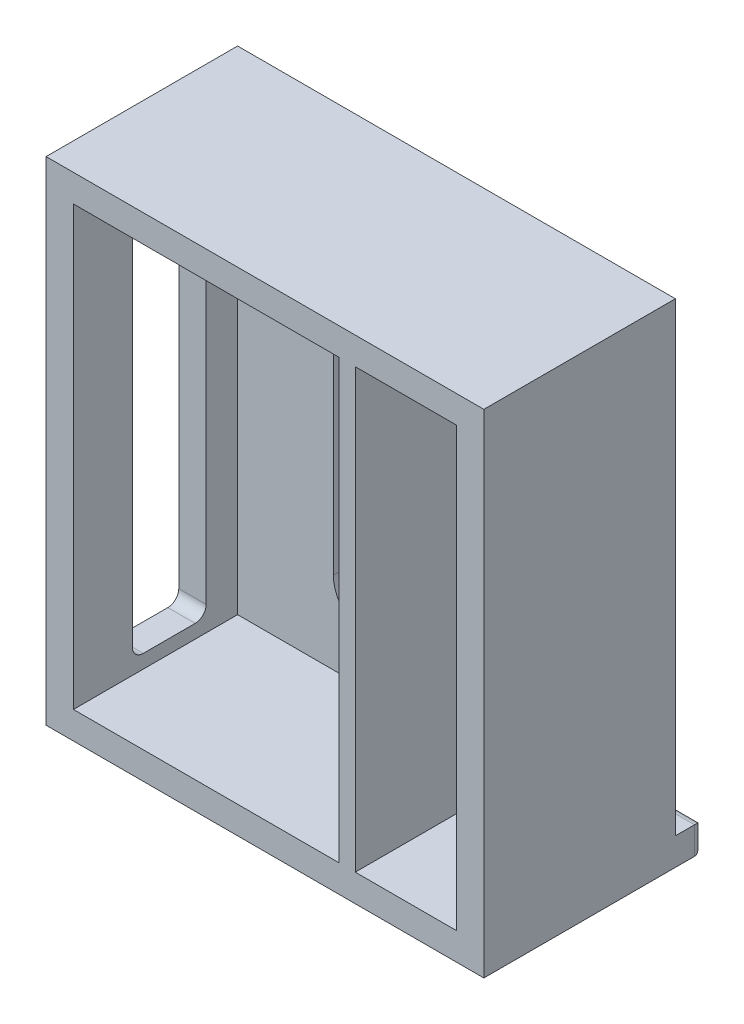
from build123d import *

# Parameters (mm, degrees)
SKETCH_1_W          = 160
SKETCH_1_H          = 70
EXTRUDE_1_DEPTH     = 180
SHELL_1_T           = -10
SKETCH_2_W          = 3
SKETCH_2_H          = 70
EXTRUDE_2_DEPTH     = 170
CUT_EXTRUDE_1_DEPTH = 170
CUT_EXTRUDE_2_DEPTH = 170
CUT_EXTRUDE_3_REACH = 245.362
SKETCH_6_W          = 160
SKETCH_6_H          = 10
EXTRUDE_3_DEPTH     = 10
FILLET_1_R          = 3


with BuildPart() as part:
    # 草图1 → 凸台-拉伸1 (new body)
    with BuildSketch(Plane(origin=(0, 0, 0), x_dir=(1, 0, 0), z_dir=(0, 1, 0))):
        Rectangle(SKETCH_1_W, SKETCH_1_H)
    extrude(amount=EXTRUDE_1_DEPTH)

    # 抽壳1
    shell_1_openings = [part.faces().sort_by_distance(p)[0] for p in [
        (0, 90, 35),
    ]]
    offset(amount=SHELL_1_T, openings=shell_1_openings, kind=Kind.INTERSECTION)

    # 草图2 → 凸台-拉伸2 (add)
    with BuildSketch(Plane.XZ):
        with Locations((31.5, 0)):
            Rectangle(SKETCH_2_W, SKETCH_2_H)
        with Locations((28.5, 0)):
            Rectangle(SKETCH_2_W, SKETCH_2_H)
    extrude(amount=-EXTRUDE_2_DEPTH)

    # 草图3 → 切除-拉伸1 (cut)
    with BuildSketch(Plane.XY.offset(-25)):
        with BuildLine():
            Line((-8, 140), (-8, 40))
            ThreePointArc((-8, 40), (-21.5, 26.5), (-35, 40))
            Line((-35, 40), (-35, 140))
            ThreePointArc((-35, 140), (-21.5, 153.5), (-8, 140))
        make_face()
    extrude(amount=-CUT_EXTRUDE_1_DEPTH, mode=Mode.SUBTRACT)

    # 草图4 → 切除-拉伸2 (cut)
    with BuildSketch(Plane.XY.offset(-25)):
        with BuildLine():
            Line((59, 137.5), (59, 42.5))
            ThreePointArc((59, 42.5), (51.5, 35), (44, 42.5))
            Line((44, 42.5), (44, 137.5))
            ThreePointArc((44, 137.5), (51.5, 145), (59, 137.5))
        make_face()
    extrude(amount=-CUT_EXTRUDE_2_DEPTH, mode=Mode.SUBTRACT)

    # 草图5 → 切除-拉伸3 (cut, up to next)
    with BuildSketch(Plane.ZY.offset(80), mode=Mode.PRIVATE) as cut_extrude_3_sk1:
        with BuildLine():
            Line((-9.5, 165), (9.5, 165))
            ThreePointArc((9.5, 165), (12.328427125, 163.828427125), (13.5, 161))
            Line((13.5, 161), (13.5, 19))
            ThreePointArc((13.5, 19), (12.328427125, 16.171572875), (9.5, 15))
            Line((9.5, 15), (-9.5, 15))
            ThreePointArc((-9.5, 15), (-12.328427125, 16.171572875), (-13.5, 19))
            Line((-13.5, 19), (-13.5, 161))
            ThreePointArc((-13.5, 161), (-12.328427125, 163.828427125), (-9.5, 165))
        make_face()
    cut_extrude_3_tool1 = extrude(cut_extrude_3_sk1.sketch, amount=-CUT_EXTRUDE_3_REACH, mode=Mode.PRIVATE) & part.part
    add(cut_extrude_3_tool1.solids().sort_by_distance((-80, 90, 0))[0], mode=Mode.SUBTRACT)

    # 草图6 → 凸台-拉伸3 (add)
    with BuildSketch(Plane(origin=(0, 0, -35), x_dir=(-1, 0, 0), z_dir=(0, 0, -1))):
        with Locations((0, 5)):
            Rectangle(SKETCH_6_W, SKETCH_6_H)
    extrude(amount=EXTRUDE_3_DEPTH)

    # 圆角1
    fillet_1_edges = [part.edges().sort_by_distance(p)[0] for p in [
        (80, 5, -45),
        (0, 0, -45),
        (-80, 5, -45),
        (0, 10, -45),
    ]]
    fillet(fillet_1_edges, radius=FILLET_1_R)


solid = part.part
